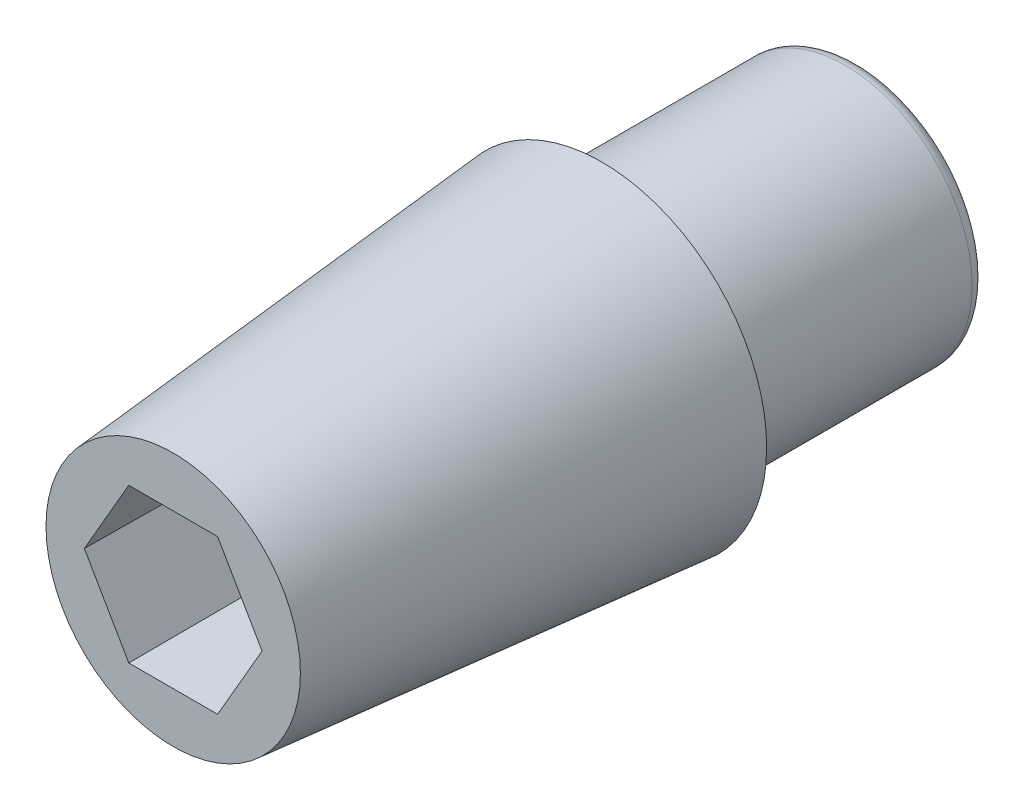
from build123d import *

# Parameters (mm, degrees)
SKETCH2_R           = 4.45
BOSS_EXTRUDE1_DEPTH = 9
CUT_EXTRUDE1_DEPTH  = 22
CUT_EXTRUDE1_DRAFT  = -0.5
FILLET1_R           = 0.1
FILLET2_R           = 0.5


with BuildPart() as part:
    # Sketch1 → Revolve1 (revolve)
    with BuildSketch(Plane(origin=(0, 0, 0), x_dir=(1, 0, 0), z_dir=(0, 1, 0))):
        Polygon((5.762329951, 0), (0, 0), (0, -15), (4.45, -15), align=None)
    revolve(axis=Axis((0, 0, 0), (0, 0, 1)))

    # Sketch2 → Boss-Extrude1 (add)
    with BuildSketch(Plane(origin=(0, 0, 0), x_dir=(-1, 0, 0), z_dir=(0, 0, -1))):
        Circle(SKETCH2_R)
    extrude(amount=BOSS_EXTRUDE1_DEPTH)


with BuildPart() as cut_extrude1_tool:
    # Sketch3 → Cut-Extrude1 (with draft: the straight prism first)
    with BuildSketch(Plane.XY.offset(15)):
        Polygon((1.554221781, 2.691991091), (-1.554221781, 2.691991091), (-3.108443563, 0), (-1.554221781, -2.691991091), (1.554221781, -2.691991091), (3.108443563, 0), align=None)
    extrude(amount=-CUT_EXTRUDE1_DEPTH)
    # Cut-Extrude1: the draft: its side faces are tilted about the plane it starts from
    cut_extrude1_sides = [cut_extrude1_tool.faces().sort_by_distance(p)[0] for p in [
        (0, 2.691991091, 4),
        (-2.331332672, 1.345995546, 4),
        (-2.331332672, -1.345995546, 4),
        (0, -2.691991091, 4),
        (2.331332672, -1.345995546, 4),
        (2.331332672, 1.345995546, 4),
    ]]
    draft(cut_extrude1_sides, Plane.XY.offset(15), CUT_EXTRUDE1_DRAFT)


with BuildPart() as part_1:
    add(part.part)

    # Cut-Extrude1: cut by cut_extrude1_tool
    add(cut_extrude1_tool.part, mode=Mode.SUBTRACT)

    # Sketch4 → Revolve2 (revolve)
    with BuildSketch(Plane(origin=(0, 0, 0), x_dir=(1, 0, 0), z_dir=(0, 1, 0))):
        Polygon((0.5, 7), (0, 7), (0, 6.75), (0.478127834, 6.75), align=None)
    revolve(axis=Axis((0, 0, -7), (0, 0, 1)))

    # Fillet1
    fillet1_edges = [part_1.edges().sort_by_distance(p)[0] for p in [
        (-0.5, 0, -7),
        (-0.478127834, 0, -6.75),
    ]]
    fillet(fillet1_edges, radius=FILLET1_R)

    # Fillet2
    fillet2_edges = [part_1.edges().sort_by_distance(p)[0] for p in [
        (4.45, 0, -9),
    ]]
    fillet(fillet2_edges, radius=FILLET2_R)


solid = part_1.part
